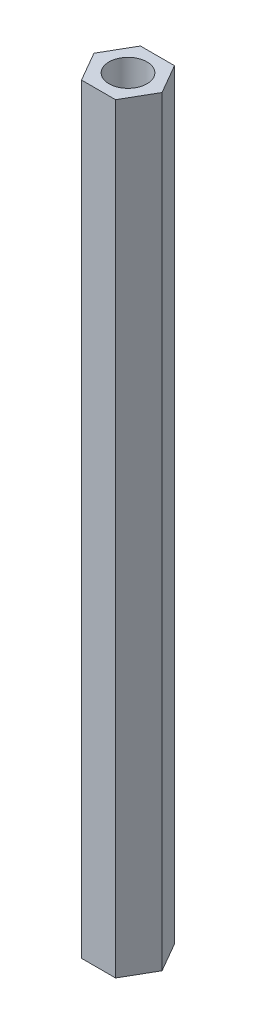
from build123d import *

# Parameters (mm, degrees)
SKETCH_1_R      = 1.5
EXTRUDE_1_DEPTH = 60


with BuildPart() as part:
    # Эскиз1 → Бобышка-Вытянуть1 (new body)
    with BuildSketch(Plane(origin=(0, 0, 0), x_dir=(1, 0, 0), z_dir=(0, 1, 0))):
        Polygon((2.684678752, 0), (1.342339376, 2.325), (-1.342339376, 2.325), (-2.684678752, 0), (-1.342339376, -2.325), (1.342339376, -2.325), align=None)
        with Locations(Location((0, 0, 0), (0, 0, 270))):
            Circle(SKETCH_1_R, mode=Mode.SUBTRACT)
    extrude(amount=EXTRUDE_1_DEPTH)


solid = part.part
